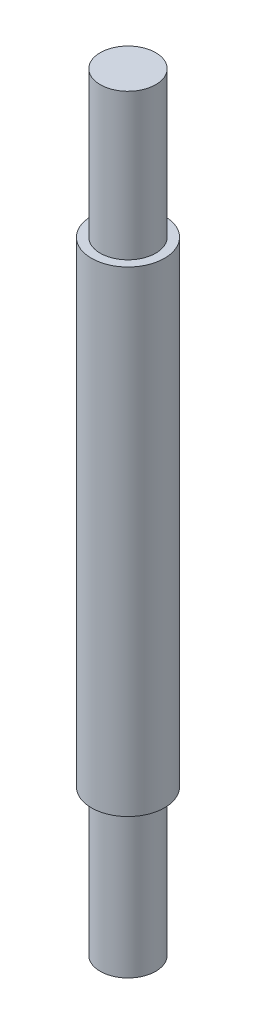
from build123d import *

# Parameters (mm, degrees)
SKETCH2_R           = 3.175
BOSS_EXTRUDE1_DEPTH = 20.701
SKETCH3_R           = 2.413
BOSS_EXTRUDE2_DEPTH = 12.7


with BuildPart() as part:
    # Sketch2 → Boss-Extrude1 (new, symmetric)
    with BuildSketch(Plane(origin=(0, 0, 0), x_dir=(1, 0, 0), z_dir=(0, 1, 0))):
        with Locations(Location((0, 0, 0), (0, 0, 270))):
            Circle(SKETCH2_R)
    extrude(amount=BOSS_EXTRUDE1_DEPTH, both=True)

    # Sketch3 → Boss-Extrude2 (add, symmetric)
    with BuildSketch(Plane(origin=(0, 20.701, 0), x_dir=(1, 0, 0), z_dir=(0, 1, 0))):
        with Locations(Location((0, 0, 0), (0, 0, 270))):
            Circle(SKETCH3_R)
    boss_extrude2 = extrude(amount=BOSS_EXTRUDE2_DEPTH, both=True)

    # Mirror1: Boss-Extrude2 across plane
    add(boss_extrude2.mirror(Plane.ZX))


solid = part.part
